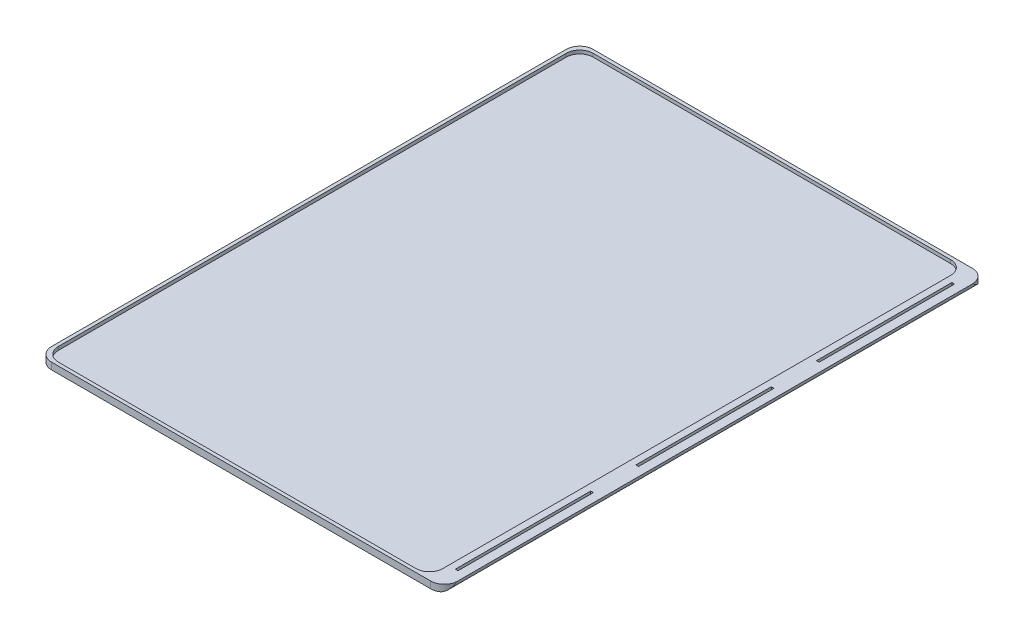
from build123d import *

# Parameters (mm, degrees)
SKETCH1_W               = 300
SKETCH1_H               = 400
BOSS_EXTRUDE1_DEPTH     = 5
CUT_EXTRUDE2_DEPTH      = 400
CUT_EXTRUDE3_DEPTH      = 251.049995001
CUT_EXTRUDE3_DEPTH_BACK = 251.049995001
SKETCH7_W               = 2
SKETCH7_H               = 100
SKETCH8_W               = 284
SKETCH8_H               = 395
CUT_EXTRUDE4_DEPTH      = 2.5
FILLET1_R               = 10
CUT_EXTRUDE5_DEPTH      = 251.049995001
CUT_EXTRUDE5_DEPTH_BACK = 251.049995001


with BuildPart() as part:
    # Sketch1 → Boss-Extrude1 (new body)
    with BuildSketch(Plane(origin=(0, 0, 0), x_dir=(1, 0, 0), z_dir=(0, 1, 0))):
        Rectangle(SKETCH1_W, SKETCH1_H)
    extrude(amount=BOSS_EXTRUDE1_DEPTH)

    # Sketch6 → Cut-Extrude2 (cut)
    with BuildSketch(Plane.XY.offset(200)):
        with BuildLine():
            Line((145, 0), (150, 0))
            Line((150, 0), (150, 5))
            ThreePointArc((150, 5), (148.535533906, 1.464466094), (145, 0))
        make_face()
    extrude(amount=-CUT_EXTRUDE2_DEPTH, mode=Mode.SUBTRACT)

    # Sketch7 → Cut-Extrude3 (cut, two sides: drawn at the far end of the back side and taken through both)
    with BuildSketch(Plane(origin=(0, 5, 0), x_dir=(1, 0, 0), z_dir=(0, 1, 0)).offset(-CUT_EXTRUDE3_DEPTH_BACK)):
        with Locations((142.5, 0)):
            Rectangle(SKETCH7_W, SKETCH7_H)
        with Locations((142.5, 133.333333333)):
            Rectangle(SKETCH7_W, SKETCH7_H)
        with Locations((142.5, -133.333333333)):
            Rectangle(SKETCH7_W, SKETCH7_H)
    extrude(amount=CUT_EXTRUDE3_DEPTH + CUT_EXTRUDE3_DEPTH_BACK, mode=Mode.SUBTRACT)

    # Sketch8 → Cut-Extrude4 (cut)
    with BuildSketch(Plane(origin=(0, 5, 0), x_dir=(1, 0, 0), z_dir=(0, 1, 0))):
        with Locations((-5.5, 0)):
            Rectangle(SKETCH8_W, SKETCH8_H)
    extrude(amount=-CUT_EXTRUDE4_DEPTH, mode=Mode.SUBTRACT)

    # Fillet1
    fillet1_edges = [part.edges().sort_by_distance(p)[0] for p in [
        (-150, 2.5, 200),
        (-150, 2.5, -200),
        (136.5, 3.75, -197.5),
        (136.5, 3.75, 197.5),
        (-147.5, 3.75, 197.5),
        (-147.5, 3.75, -197.5),
    ]]
    fillet(fillet1_edges, radius=FILLET1_R)

    # Sketch9 → Cut-Extrude5 (cut, two sides: drawn at the far end of the back side and taken through both)
    with BuildSketch(Plane(origin=(0, 5, 0), x_dir=(1, 0, 0), z_dir=(0, 1, 0)).offset(-CUT_EXTRUDE5_DEPTH_BACK)):
        with BuildLine():
            Line((140, 200), (150, 200))
            Line((150, 200), (150, 190))
            ThreePointArc((150, 190), (147.071067812, 197.071067812), (140, 200))
        make_face()
        with BuildLine():
            Line((150, -200), (150, -190))
            ThreePointArc((150, -190), (147.071067812, -197.071067812), (140, -200))
            Line((140, -200), (150, -200))
        make_face()
    extrude(amount=CUT_EXTRUDE5_DEPTH + CUT_EXTRUDE5_DEPTH_BACK, mode=Mode.SUBTRACT)


solid = part.part
